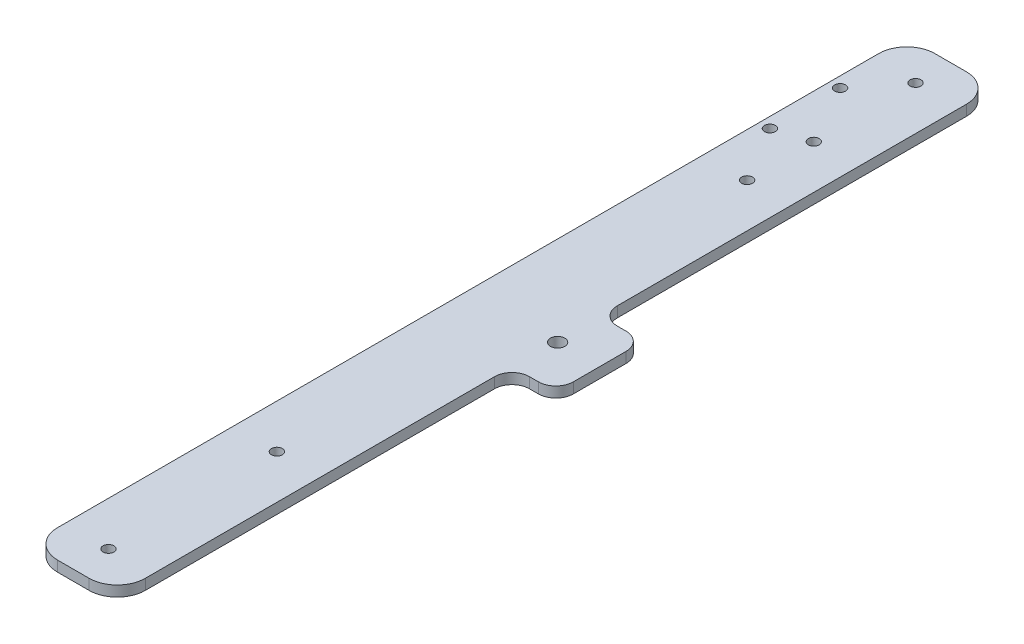
from build123d import *

# Parameters (mm, degrees)
SKETCH_1_W          = 25
SKETCH_1_H          = 250
EXTRUDE_1_DEPTH     = 3
SKETCH_2_R          = 1.55
CUT_EXTRUDE_1_DEPTH = 3
SKETCH_3_R          = 1.55
CUT_EXTRUDE_2_DEPTH = 10
SKETCH_5_W          = 25
SKETCH_5_H          = 25
EXTRUDE_2_DEPTH     = 3
SKETCH_6_R          = 2.05
CUT_EXTRUDE_3_DEPTH = 10
SKETCH_7_R          = 1.55
CUT_EXTRUDE_4_DEPTH = 10
FILLET_1_R          = 5
FILLET_2_R          = 8


with BuildPart() as part:
    # 草图1 → 凸台-拉伸1 (new body)
    with BuildSketch(Plane(origin=(0, 0, 0), x_dir=(1, 0, 0), z_dir=(0, 1, 0))):
        Rectangle(SKETCH_1_W, SKETCH_1_H)
    extrude(amount=EXTRUDE_1_DEPTH)

    # 草图2 → 切除-拉伸1 (cut)
    with BuildSketch(Plane(origin=(0, 0, 0), x_dir=(-1, 0, 0), z_dir=(0, -1, 0))):
        with Locations(Location((0, 115, 0), (0, 0, 90))):
            Circle(SKETCH_2_R)
        with Locations(Location((0, 67, 0), (0, 0, 90))):
            Circle(SKETCH_2_R)
        with Locations(Location((0, -67, 0), (0, 0, 90))):
            Circle(SKETCH_2_R)
        with Locations(Location((0, -115, 0), (0, 0, 90))):
            Circle(SKETCH_2_R)
    extrude(amount=-CUT_EXTRUDE_1_DEPTH, mode=Mode.SUBTRACT)

    # 草图3 → 切除-拉伸2 (cut)
    with BuildSketch(Plane(origin=(0, 0, 0), x_dir=(-1, 0, 0), z_dir=(0, -1, 0))):
        with Locations(Location((9.5, 83, 0), (0, 0, 90))):
            Circle(SKETCH_3_R)
        with Locations(Location((9.5, 103, 0), (0, 0, 90))):
            Circle(SKETCH_3_R)
    extrude(amount=-CUT_EXTRUDE_2_DEPTH, mode=Mode.SUBTRACT)

    # 草图5 → 凸台-拉伸2 (add, through all)
    with BuildSketch(Plane(origin=(0, 0, 0), x_dir=(-1, 0, 0), z_dir=(0, -1, 0))):
        with Locations((-12.5, 0)):
            Rectangle(SKETCH_5_W, SKETCH_5_H)
    extrude(amount=-EXTRUDE_2_DEPTH)

    # 草图6 → 切除-拉伸3 (cut)
    with BuildSketch(Plane(origin=(0, 0, 0), x_dir=(-1, 0, 0), z_dir=(0, -1, 0))):
        with Locations(Location((-13, 0, 0), (0, 0, 90))):
            Circle(SKETCH_6_R)
    extrude(amount=-CUT_EXTRUDE_3_DEPTH, mode=Mode.SUBTRACT)

    # 草图7 → 切除-拉伸4 (cut)
    with BuildSketch(Plane(origin=(0, 0, 0), x_dir=(-1, 0, 0), z_dir=(0, -1, 0))):
        with Locations(Location((0, 86, 0), (0, 0, 90))):
            Circle(SKETCH_7_R)
    extrude(amount=-CUT_EXTRUDE_4_DEPTH, mode=Mode.SUBTRACT)

    # 圆角1
    fillet_1_edges = [part.edges().sort_by_distance(p)[0] for p in [
        (25, 1.5, -12.5),
        (12.5, 1.5, 12.5),
        (25, 1.5, 12.5),
        (12.5, 1.5, -12.5),
    ]]
    fillet(fillet_1_edges, radius=FILLET_1_R)

    # 圆角2
    fillet_2_edges = [part.edges().sort_by_distance(p)[0] for p in [
        (12.5, 1.5, 125),
        (-12.5, 1.5, 125),
        (-12.5, 1.5, -125),
        (12.5, 1.5, -125),
    ]]
    fillet(fillet_2_edges, radius=FILLET_2_R)


solid = part.part
